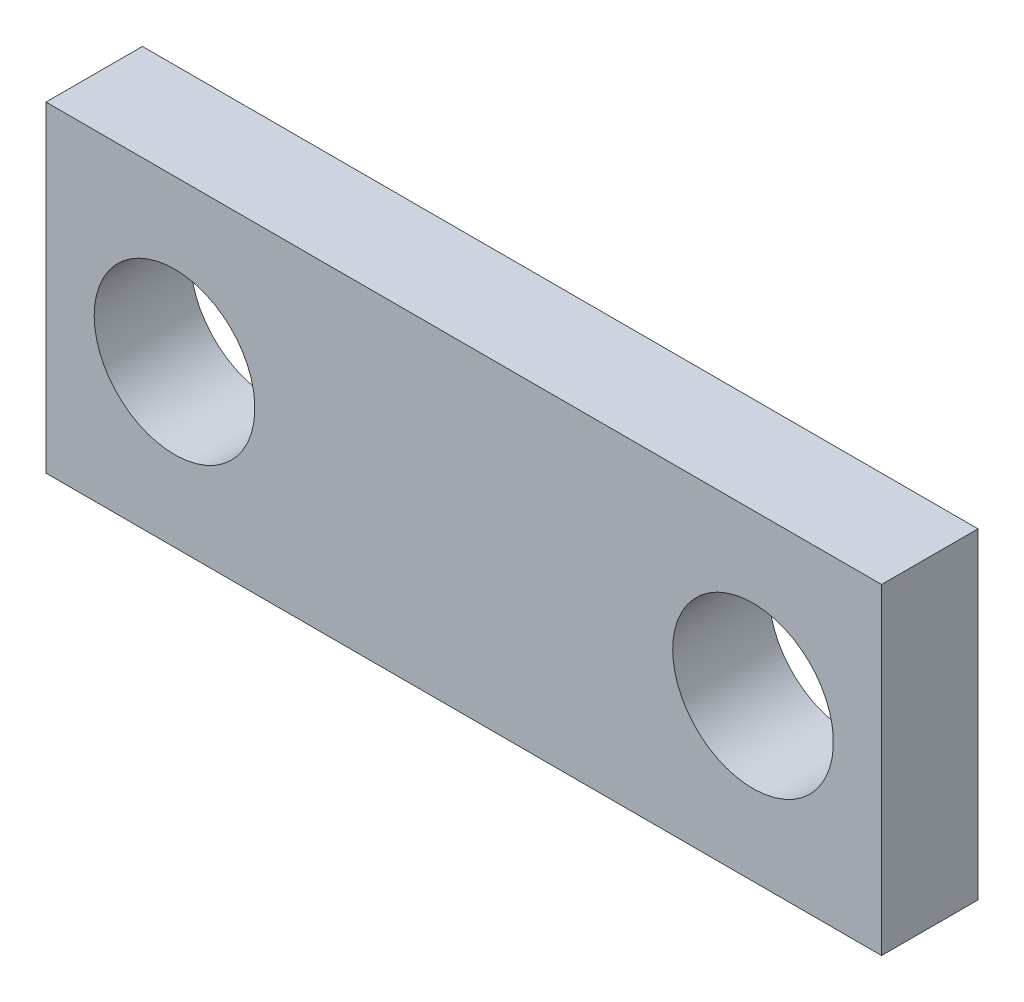
from build123d import *

# Parameters (mm, degrees)
SKETCH_1_W      = 26
SKETCH_1_H      = 10
SKETCH_1_R      = 2.5
EXTRUDE_1_DEPTH = 3


with BuildPart() as part:
    # Эскиз1 → Бобышка-Вытянуть1 (new body)
    with BuildSketch(Plane.XY.offset(3)):
        Rectangle(SKETCH_1_W, SKETCH_1_H)
        with Locations(Location((9, 0, 0), (0, 0, 180))):
            Circle(SKETCH_1_R, mode=Mode.SUBTRACT)
        with Locations(Location((-9, 0, 0), (0, 0, 180))):
            Circle(SKETCH_1_R, mode=Mode.SUBTRACT)
    extrude(amount=-EXTRUDE_1_DEPTH)


solid = part.part
